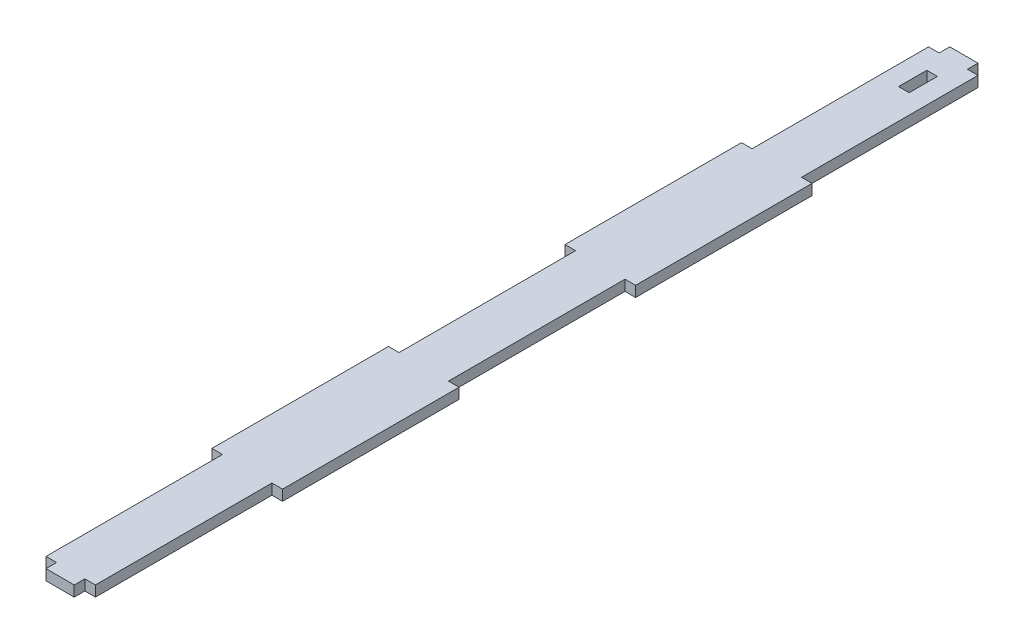
from build123d import *

# Parameters (mm, degrees)
SALIENTE_EXTRUIR1_DEPTH = 3


with BuildPart() as part:
    # Croquis1 → Saliente-Extruir1 (new body)
    with BuildSketch(Plane(origin=(0, 0, 0), x_dir=(1, 0, 0), z_dir=(0, 1, 0))):
        Polygon((14, 253.116176228), (10, 253.116176228), (6, 253.116176228), (6, 250.116176228), (3, 250.116176228), (3, 200.116176228), (0, 200.116176228), (0, 150.116176228), (3, 150.116176228), (3, 100.116176228), (0, 100.116176228), (0, 50.116176228), (3, 50.116176228), (3, 0.116176228), (6, 0.116176228), (6, -2.883823772), (14, -2.883823772), (14, 0.116176228), (17, 0.116176228), (17, 50.116176228), (20, 50.116176228), (20, 100.116176228), (17, 100.116176228), (17, 150.116176228), (20, 150.116176228), (20, 200.116176228), (17, 200.116176228), (17, 250.116176228), (14, 250.116176228), align=None)
        Polygon((8.5, 244.116176228), (10, 244.116176228), (11.5, 244.116176228), (11.5, 236.116176228), (8.5, 236.116176228), align=None, mode=Mode.SUBTRACT)
    extrude(amount=SALIENTE_EXTRUIR1_DEPTH)


solid = part.part
